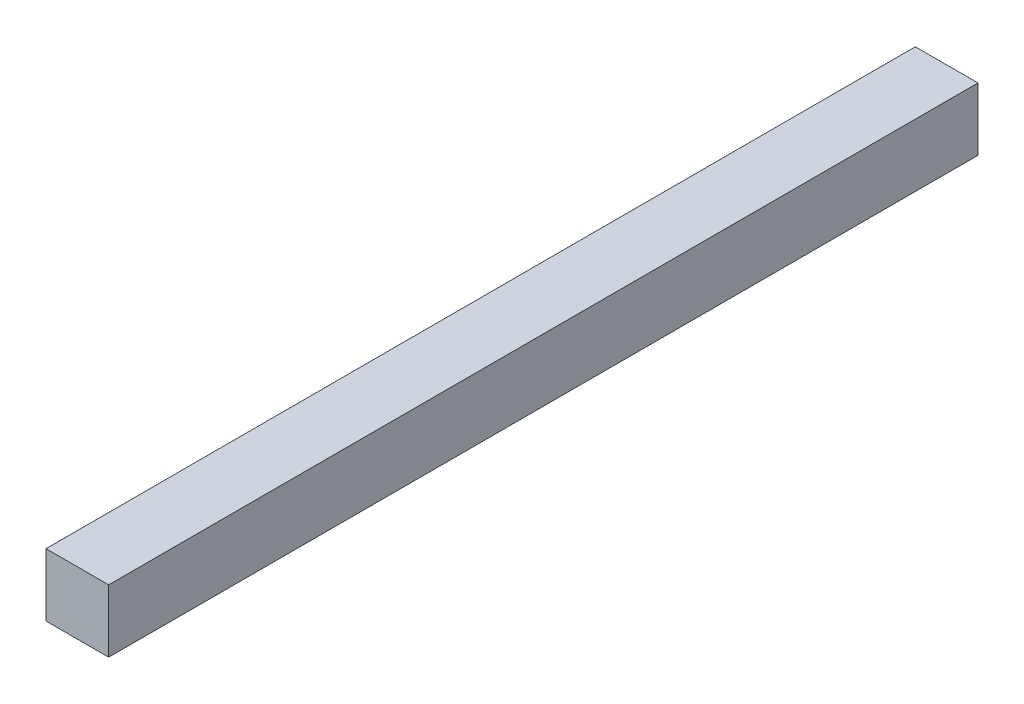
from build123d import *

# Parameters (mm, degrees)
ESQUISSE1_W             = 62
ESQUISSE1_H             = 62
BOSS_EXTRU_1_DEPTH      = 860
ESQUISSE2_R             = 6
ENL_V_MAT_EXTRU_1_DEPTH = 80


with BuildPart() as part:
    # Esquisse1 → Boss.-Extru.1 (new body)
    with BuildSketch(Plane.XY):
        with Locations((31, 31)):
            Rectangle(ESQUISSE1_W, ESQUISSE1_H)
    extrude(amount=BOSS_EXTRU_1_DEPTH)

    # Esquisse2 → Enlèv. mat.-Extru.1 (cut)
    with BuildSketch(Plane.XY):
        with Locations((31, 31)):
            Circle(ESQUISSE2_R)
    extrude(amount=ENL_V_MAT_EXTRU_1_DEPTH, mode=Mode.SUBTRACT)


solid = part.part
